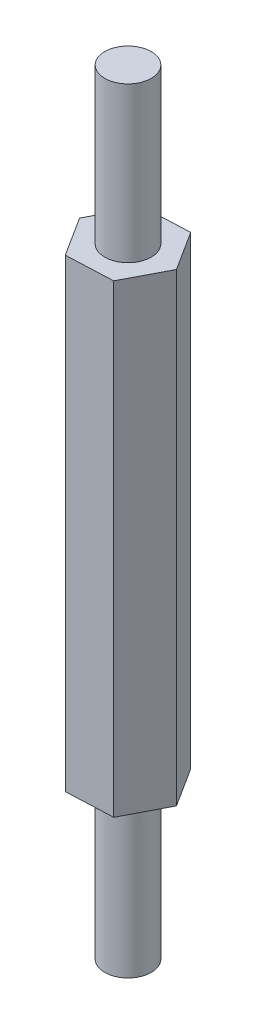
from build123d import *

# Parameters (mm, degrees)
BOSS_EXTRUDE1_DEPTH = 30
SKETCH4_R           = 1.5
BOSS_EXTRUDE2_DEPTH = 10
BOSS_EXTRUDE3_START = 10
SKETCH5_R           = 1.5
BOSS_EXTRUDE3_DEPTH = 10


with BuildPart() as part:
    # Sketch3 → Boss-Extrude1 (new body)
    with BuildSketch(Plane(origin=(0, 0, 0), x_dir=(1, 0, 0), z_dir=(0, 1, 0))):
        Polygon((1.388964752, 2.662182442), (-1.611035248, 2.533969981), (-3, -0.12821246), (-1.388964752, -2.662182442), (1.611035248, -2.533969981), (3, 0.12821246), align=None)
    extrude(amount=BOSS_EXTRUDE1_DEPTH)

    # Sketch4 → Boss-Extrude2 (add)
    with BuildSketch(Plane(origin=(0, 30, 0), x_dir=(1, 0, 0), z_dir=(0, 1, 0))):
        with Locations(Location((0, 0, 0), (0, 0, 270))):
            Circle(SKETCH4_R)
    extrude(amount=BOSS_EXTRUDE2_DEPTH)

    # Sketch5 → Boss-Extrude3 (add)
    with BuildSketch(Plane.XZ.offset(BOSS_EXTRUDE3_START)):
        with Locations(Location((0, 0, 0), (0, 0, 90))):
            Circle(SKETCH5_R)
    extrude(amount=-BOSS_EXTRUDE3_DEPTH)


solid = part.part
